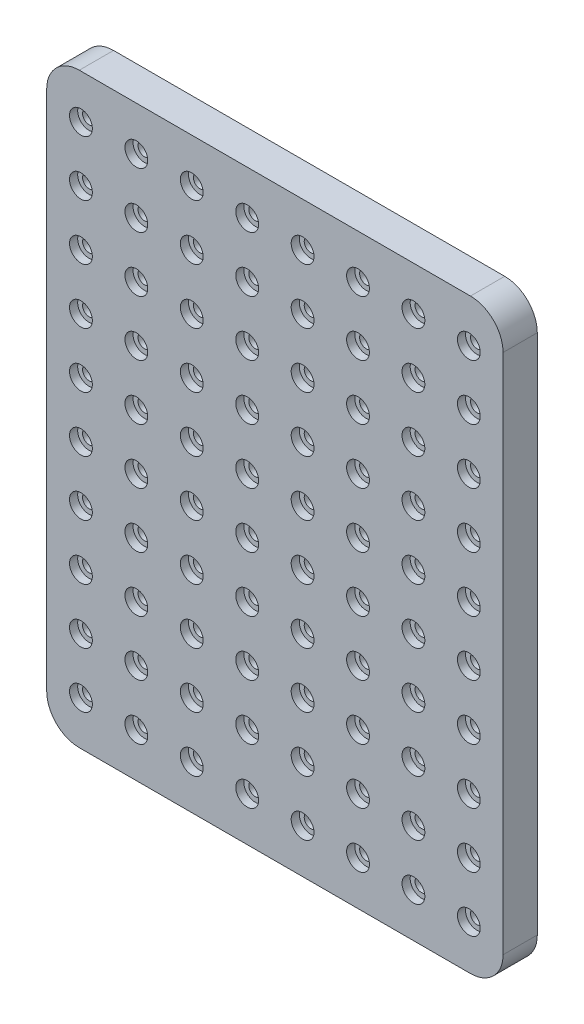
from build123d import *

# Parameters (mm, degrees)
SKIZZE1_W                       = 140
SKIZZE1_H                       = 180
AUFSATZ_LINEAR_AUSTRAGEN1_DEPTH = 10.5
SKIZZE2_R                       = 3.5
SCHNITT_LINEAR_AUSTRAGEN3_DEPTH = 2.5
SKIZZE3_R                       = 2
SCHNITT_LINEAR_AUSTRAGEN5_DEPTH = 229.276696139
VERRUNDUNG1_R                   = 10


with BuildPart() as part:
    # Skizze1 → Aufsatz-Linear austragen1 (new body)
    with BuildSketch(Plane.XY):
        with Locations((70, 90)):
            Rectangle(SKIZZE1_W, SKIZZE1_H)
    extrude(amount=AUFSATZ_LINEAR_AUSTRAGEN1_DEPTH)

    # Skizze2 → Schnitt-Linear austragen3 (cut)
    with BuildSketch(Plane.XY.offset(10.5)):
        with Locations((10.5, 183.5)):
            Circle(SKIZZE2_R)
        with Locations((27.5, 183.5)):
            Circle(SKIZZE2_R)
        with Locations((44.5, 183.5)):
            Circle(SKIZZE2_R)
        with Locations((61.5, 183.5)):
            Circle(SKIZZE2_R)
        with Locations((78.5, 183.5)):
            Circle(SKIZZE2_R)
        with Locations((95.5, 183.5)):
            Circle(SKIZZE2_R)
        with Locations((112.5, 183.5)):
            Circle(SKIZZE2_R)
        with Locations((129.5, 183.5)):
            Circle(SKIZZE2_R)
        with Locations((27.5, 166.5)):
            Circle(SKIZZE2_R)
        with Locations((44.5, 166.5)):
            Circle(SKIZZE2_R)
        with Locations((61.5, 166.5)):
            Circle(SKIZZE2_R)
        with Locations((78.5, 166.5)):
            Circle(SKIZZE2_R)
        with Locations((95.5, 166.5)):
            Circle(SKIZZE2_R)
        with Locations((112.5, 166.5)):
            Circle(SKIZZE2_R)
        with Locations((129.5, 166.5)):
            Circle(SKIZZE2_R)
        with Locations((27.5, 149.5)):
            Circle(SKIZZE2_R)
        with Locations((44.5, 149.5)):
            Circle(SKIZZE2_R)
        with Locations((61.5, 149.5)):
            Circle(SKIZZE2_R)
        with Locations((78.5, 149.5)):
            Circle(SKIZZE2_R)
        with Locations((95.5, 149.5)):
            Circle(SKIZZE2_R)
        with Locations((112.5, 149.5)):
            Circle(SKIZZE2_R)
        with Locations((129.5, 149.5)):
            Circle(SKIZZE2_R)
        with Locations((27.5, 132.5)):
            Circle(SKIZZE2_R)
        with Locations((44.5, 132.5)):
            Circle(SKIZZE2_R)
        with Locations((61.5, 132.5)):
            Circle(SKIZZE2_R)
        with Locations((78.5, 132.5)):
            Circle(SKIZZE2_R)
        with Locations((95.5, 132.5)):
            Circle(SKIZZE2_R)
        with Locations((112.5, 132.5)):
            Circle(SKIZZE2_R)
        with Locations((129.5, 132.5)):
            Circle(SKIZZE2_R)
        with Locations((27.5, 115.5)):
            Circle(SKIZZE2_R)
        with Locations((44.5, 115.5)):
            Circle(SKIZZE2_R)
        with Locations((61.5, 115.5)):
            Circle(SKIZZE2_R)
        with Locations((78.5, 115.5)):
            Circle(SKIZZE2_R)
        with Locations((95.5, 115.5)):
            Circle(SKIZZE2_R)
        with Locations((112.5, 115.5)):
            Circle(SKIZZE2_R)
        with Locations((129.5, 115.5)):
            Circle(SKIZZE2_R)
        with Locations((27.5, 98.5)):
            Circle(SKIZZE2_R)
        with Locations((44.5, 98.5)):
            Circle(SKIZZE2_R)
        with Locations((61.5, 98.5)):
            Circle(SKIZZE2_R)
        with Locations((78.5, 98.5)):
            Circle(SKIZZE2_R)
        with Locations((95.5, 98.5)):
            Circle(SKIZZE2_R)
        with Locations((112.5, 98.5)):
            Circle(SKIZZE2_R)
        with Locations((129.5, 98.5)):
            Circle(SKIZZE2_R)
        with Locations((27.5, 81.5)):
            Circle(SKIZZE2_R)
        with Locations((44.5, 81.5)):
            Circle(SKIZZE2_R)
        with Locations((61.5, 81.5)):
            Circle(SKIZZE2_R)
        with Locations((78.5, 81.5)):
            Circle(SKIZZE2_R)
        with Locations((95.5, 81.5)):
            Circle(SKIZZE2_R)
        with Locations((112.5, 81.5)):
            Circle(SKIZZE2_R)
        with Locations((129.5, 81.5)):
            Circle(SKIZZE2_R)
        with Locations((27.5, 64.5)):
            Circle(SKIZZE2_R)
        with Locations((44.5, 64.5)):
            Circle(SKIZZE2_R)
        with Locations((61.5, 64.5)):
            Circle(SKIZZE2_R)
        with Locations((78.5, 64.5)):
            Circle(SKIZZE2_R)
        with Locations((95.5, 64.5)):
            Circle(SKIZZE2_R)
        with Locations((112.5, 64.5)):
            Circle(SKIZZE2_R)
        with Locations((129.5, 64.5)):
            Circle(SKIZZE2_R)
        with Locations((27.5, 47.5)):
            Circle(SKIZZE2_R)
        with Locations((44.5, 47.5)):
            Circle(SKIZZE2_R)
        with Locations((61.5, 47.5)):
            Circle(SKIZZE2_R)
        with Locations((78.5, 47.5)):
            Circle(SKIZZE2_R)
        with Locations((95.5, 47.5)):
            Circle(SKIZZE2_R)
        with Locations((112.5, 47.5)):
            Circle(SKIZZE2_R)
        with Locations((129.5, 47.5)):
            Circle(SKIZZE2_R)
        with Locations((27.5, 30.5)):
            Circle(SKIZZE2_R)
        with Locations((44.5, 30.5)):
            Circle(SKIZZE2_R)
        with Locations((61.5, 30.5)):
            Circle(SKIZZE2_R)
        with Locations((78.5, 30.5)):
            Circle(SKIZZE2_R)
        with Locations((95.5, 30.5)):
            Circle(SKIZZE2_R)
        with Locations((112.5, 30.5)):
            Circle(SKIZZE2_R)
        with Locations((129.5, 30.5)):
            Circle(SKIZZE2_R)
        with Locations((27.5, 13.5)):
            Circle(SKIZZE2_R)
        with Locations((44.5, 13.5)):
            Circle(SKIZZE2_R)
        with Locations((61.5, 13.5)):
            Circle(SKIZZE2_R)
        with Locations((78.5, 13.5)):
            Circle(SKIZZE2_R)
        with Locations((95.5, 13.5)):
            Circle(SKIZZE2_R)
        with Locations((112.5, 13.5)):
            Circle(SKIZZE2_R)
        with Locations((129.5, 13.5)):
            Circle(SKIZZE2_R)
        with Locations((10.5, 166.5)):
            Circle(SKIZZE2_R)
        with Locations((10.5, 149.5)):
            Circle(SKIZZE2_R)
        with Locations((10.5, 132.5)):
            Circle(SKIZZE2_R)
        with Locations((10.5, 115.5)):
            Circle(SKIZZE2_R)
        with Locations((10.5, 98.5)):
            Circle(SKIZZE2_R)
        with Locations((10.5, 81.5)):
            Circle(SKIZZE2_R)
        with Locations((10.5, 64.5)):
            Circle(SKIZZE2_R)
        with Locations((10.5, 47.5)):
            Circle(SKIZZE2_R)
        with Locations((10.5, 30.5)):
            Circle(SKIZZE2_R)
        with Locations((10.5, 13.5)):
            Circle(SKIZZE2_R)
    extrude(amount=-SCHNITT_LINEAR_AUSTRAGEN3_DEPTH, mode=Mode.SUBTRACT)

    # Skizze3 → Schnitt-Linear austragen5 (cut, through all)
    with BuildSketch(Plane.XY):
        with Locations((10.5, 183.5)):
            Circle(SKIZZE3_R)
        with Locations((27.5, 183.5)):
            Circle(SKIZZE3_R)
        with Locations((44.5, 183.5)):
            Circle(SKIZZE3_R)
        with Locations((61.5, 183.5)):
            Circle(SKIZZE3_R)
        with Locations((78.5, 183.5)):
            Circle(SKIZZE3_R)
        with Locations((95.5, 183.5)):
            Circle(SKIZZE3_R)
        with Locations((112.5, 183.5)):
            Circle(SKIZZE3_R)
        with Locations((129.5, 183.5)):
            Circle(SKIZZE3_R)
        with Locations(Location((27.5, 166.5, 0), (0, 0, 180))):
            Circle(SKIZZE3_R)
        with Locations(Location((44.5, 166.5, 0), (0, 0, 180))):
            Circle(SKIZZE3_R)
        with Locations(Location((61.5, 166.5, 0), (0, 0, 180))):
            Circle(SKIZZE3_R)
        with Locations(Location((78.5, 166.5, 0), (0, 0, 180))):
            Circle(SKIZZE3_R)
        with Locations(Location((95.5, 166.5, 0), (0, 0, 180))):
            Circle(SKIZZE3_R)
        with Locations(Location((112.5, 166.5, 0), (0, 0, 180))):
            Circle(SKIZZE3_R)
        with Locations(Location((129.5, 166.5, 0), (0, 0, 180))):
            Circle(SKIZZE3_R)
        with Locations(Location((27.5, 149.5, 0), (0, 0, 180))):
            Circle(SKIZZE3_R)
        with Locations(Location((44.5, 149.5, 0), (0, 0, 180))):
            Circle(SKIZZE3_R)
        with Locations(Location((61.5, 149.5, 0), (0, 0, 180))):
            Circle(SKIZZE3_R)
        with Locations(Location((78.5, 149.5, 0), (0, 0, 180))):
            Circle(SKIZZE3_R)
        with Locations(Location((95.5, 149.5, 0), (0, 0, 180))):
            Circle(SKIZZE3_R)
        with Locations(Location((112.5, 149.5, 0), (0, 0, 180))):
            Circle(SKIZZE3_R)
        with Locations(Location((129.5, 149.5, 0), (0, 0, 180))):
            Circle(SKIZZE3_R)
        with Locations(Location((27.5, 132.5, 0), (0, 0, 180))):
            Circle(SKIZZE3_R)
        with Locations(Location((44.5, 132.5, 0), (0, 0, 180))):
            Circle(SKIZZE3_R)
        with Locations(Location((61.5, 132.5, 0), (0, 0, 180))):
            Circle(SKIZZE3_R)
        with Locations(Location((78.5, 132.5, 0), (0, 0, 180))):
            Circle(SKIZZE3_R)
        with Locations(Location((95.5, 132.5, 0), (0, 0, 180))):
            Circle(SKIZZE3_R)
        with Locations(Location((112.5, 132.5, 0), (0, 0, 180))):
            Circle(SKIZZE3_R)
        with Locations(Location((129.5, 132.5, 0), (0, 0, 180))):
            Circle(SKIZZE3_R)
        with Locations(Location((27.5, 115.5, 0), (0, 0, 180))):
            Circle(SKIZZE3_R)
        with Locations(Location((44.5, 115.5, 0), (0, 0, 180))):
            Circle(SKIZZE3_R)
        with Locations(Location((61.5, 115.5, 0), (0, 0, 180))):
            Circle(SKIZZE3_R)
        with Locations(Location((78.5, 115.5, 0), (0, 0, 180))):
            Circle(SKIZZE3_R)
        with Locations(Location((95.5, 115.5, 0), (0, 0, 180))):
            Circle(SKIZZE3_R)
        with Locations(Location((112.5, 115.5, 0), (0, 0, 180))):
            Circle(SKIZZE3_R)
        with Locations(Location((129.5, 115.5, 0), (0, 0, 180))):
            Circle(SKIZZE3_R)
        with Locations(Location((27.5, 98.5, 0), (0, 0, 180))):
            Circle(SKIZZE3_R)
        with Locations(Location((44.5, 98.5, 0), (0, 0, 180))):
            Circle(SKIZZE3_R)
        with Locations(Location((61.5, 98.5, 0), (0, 0, 180))):
            Circle(SKIZZE3_R)
        with Locations(Location((78.5, 98.5, 0), (0, 0, 180))):
            Circle(SKIZZE3_R)
        with Locations(Location((95.5, 98.5, 0), (0, 0, 180))):
            Circle(SKIZZE3_R)
        with Locations(Location((112.5, 98.5, 0), (0, 0, 180))):
            Circle(SKIZZE3_R)
        with Locations(Location((129.5, 98.5, 0), (0, 0, 180))):
            Circle(SKIZZE3_R)
        with Locations(Location((27.5, 81.5, 0), (0, 0, 180))):
            Circle(SKIZZE3_R)
        with Locations(Location((44.5, 81.5, 0), (0, 0, 180))):
            Circle(SKIZZE3_R)
        with Locations(Location((61.5, 81.5, 0), (0, 0, 180))):
            Circle(SKIZZE3_R)
        with Locations(Location((78.5, 81.5, 0), (0, 0, 180))):
            Circle(SKIZZE3_R)
        with Locations(Location((95.5, 81.5, 0), (0, 0, 180))):
            Circle(SKIZZE3_R)
        with Locations(Location((112.5, 81.5, 0), (0, 0, 180))):
            Circle(SKIZZE3_R)
        with Locations(Location((129.5, 81.5, 0), (0, 0, 180))):
            Circle(SKIZZE3_R)
        with Locations(Location((27.5, 64.5, 0), (0, 0, 180))):
            Circle(SKIZZE3_R)
        with Locations(Location((44.5, 64.5, 0), (0, 0, 180))):
            Circle(SKIZZE3_R)
        with Locations(Location((61.5, 64.5, 0), (0, 0, 180))):
            Circle(SKIZZE3_R)
        with Locations(Location((78.5, 64.5, 0), (0, 0, 180))):
            Circle(SKIZZE3_R)
        with Locations(Location((95.5, 64.5, 0), (0, 0, 180))):
            Circle(SKIZZE3_R)
        with Locations(Location((112.5, 64.5, 0), (0, 0, 180))):
            Circle(SKIZZE3_R)
        with Locations(Location((129.5, 64.5, 0), (0, 0, 180))):
            Circle(SKIZZE3_R)
        with Locations(Location((27.5, 47.5, 0), (0, 0, 180))):
            Circle(SKIZZE3_R)
        with Locations(Location((44.5, 47.5, 0), (0, 0, 180))):
            Circle(SKIZZE3_R)
        with Locations(Location((61.5, 47.5, 0), (0, 0, 180))):
            Circle(SKIZZE3_R)
        with Locations(Location((78.5, 47.5, 0), (0, 0, 180))):
            Circle(SKIZZE3_R)
        with Locations(Location((95.5, 47.5, 0), (0, 0, 180))):
            Circle(SKIZZE3_R)
        with Locations(Location((112.5, 47.5, 0), (0, 0, 180))):
            Circle(SKIZZE3_R)
        with Locations(Location((129.5, 47.5, 0), (0, 0, 180))):
            Circle(SKIZZE3_R)
        with Locations(Location((27.5, 30.5, 0), (0, 0, 180))):
            Circle(SKIZZE3_R)
        with Locations(Location((44.5, 30.5, 0), (0, 0, 180))):
            Circle(SKIZZE3_R)
        with Locations(Location((61.5, 30.5, 0), (0, 0, 180))):
            Circle(SKIZZE3_R)
        with Locations(Location((78.5, 30.5, 0), (0, 0, 180))):
            Circle(SKIZZE3_R)
        with Locations(Location((95.5, 30.5, 0), (0, 0, 180))):
            Circle(SKIZZE3_R)
        with Locations(Location((112.5, 30.5, 0), (0, 0, 180))):
            Circle(SKIZZE3_R)
        with Locations(Location((129.5, 30.5, 0), (0, 0, 180))):
            Circle(SKIZZE3_R)
        with Locations(Location((27.5, 13.5, 0), (0, 0, 180))):
            Circle(SKIZZE3_R)
        with Locations(Location((44.5, 13.5, 0), (0, 0, 180))):
            Circle(SKIZZE3_R)
        with Locations(Location((61.5, 13.5, 0), (0, 0, 180))):
            Circle(SKIZZE3_R)
        with Locations(Location((78.5, 13.5, 0), (0, 0, 180))):
            Circle(SKIZZE3_R)
        with Locations(Location((95.5, 13.5, 0), (0, 0, 180))):
            Circle(SKIZZE3_R)
        with Locations(Location((112.5, 13.5, 0), (0, 0, 180))):
            Circle(SKIZZE3_R)
        with Locations(Location((129.5, 13.5, 0), (0, 0, 180))):
            Circle(SKIZZE3_R)
        with Locations((27.5, -3.5)):
            Circle(SKIZZE3_R)
        with Locations((44.5, -3.5)):
            Circle(SKIZZE3_R)
        with Locations((61.5, -3.5)):
            Circle(SKIZZE3_R)
        with Locations((78.5, -3.5)):
            Circle(SKIZZE3_R)
        with Locations((95.5, -3.5)):
            Circle(SKIZZE3_R)
        with Locations((112.5, -3.5)):
            Circle(SKIZZE3_R)
        with Locations((129.5, -3.5)):
            Circle(SKIZZE3_R)
        with Locations(Location((10.5, 166.5, 0), (0, 0, 180))):
            Circle(SKIZZE3_R)
        with Locations(Location((10.5, 149.5, 0), (0, 0, 180))):
            Circle(SKIZZE3_R)
        with Locations(Location((10.5, 132.5, 0), (0, 0, 180))):
            Circle(SKIZZE3_R)
        with Locations(Location((10.5, 115.5, 0), (0, 0, 180))):
            Circle(SKIZZE3_R)
        with Locations(Location((10.5, 98.5, 0), (0, 0, 180))):
            Circle(SKIZZE3_R)
        with Locations(Location((10.5, 81.5, 0), (0, 0, 180))):
            Circle(SKIZZE3_R)
        with Locations(Location((10.5, 64.5, 0), (0, 0, 180))):
            Circle(SKIZZE3_R)
        with Locations(Location((10.5, 47.5, 0), (0, 0, 180))):
            Circle(SKIZZE3_R)
        with Locations(Location((10.5, 30.5, 0), (0, 0, 180))):
            Circle(SKIZZE3_R)
        with Locations(Location((10.5, 13.5, 0), (0, 0, 180))):
            Circle(SKIZZE3_R)
        with Locations((10.5, -3.5)):
            Circle(SKIZZE3_R)
    extrude(amount=SCHNITT_LINEAR_AUSTRAGEN5_DEPTH, mode=Mode.SUBTRACT)

    # Verrundung1
    verrundung1_edges = [part.edges().sort_by_distance(p)[0] for p in [
        (0, 180, 5.25),
        (140, 180, 5.25),
        (140, 0, 5.25),
        (0, 0, 5.25),
    ]]
    fillet(verrundung1_edges, radius=VERRUNDUNG1_R)


solid = part.part
